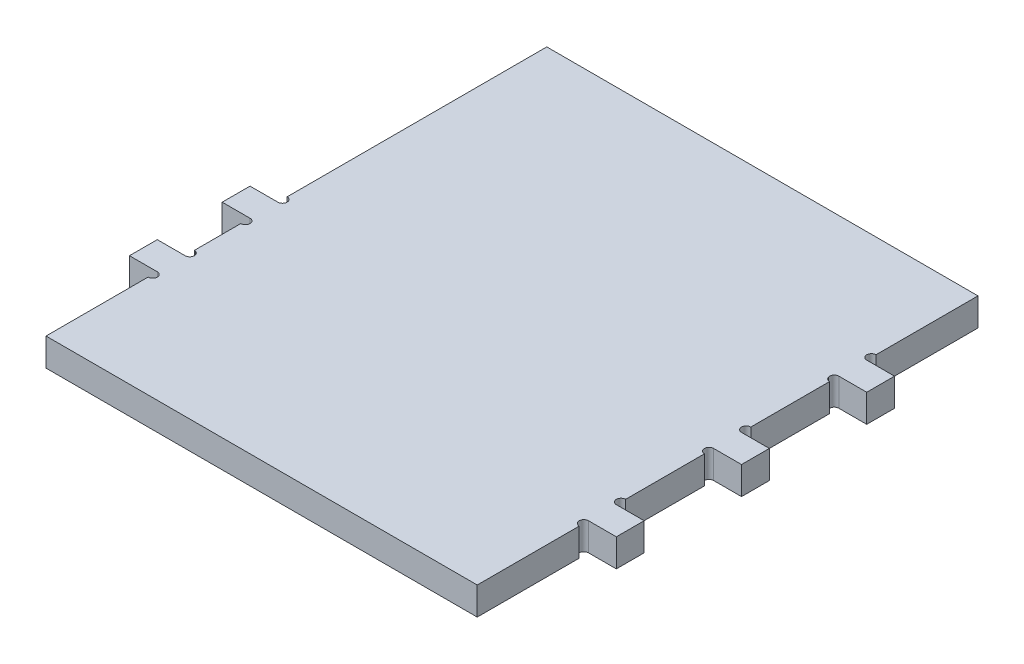
from build123d import *

# Parameters (mm, degrees)
BOSS_EXTRUDE1_DEPTH     = 19.05
CUT_EXTRUDE1_DEPTH      = 466.557212515
CUT_EXTRUDE1_DEPTH_BACK = 466.557212515


with BuildPart() as part:
    # Sketch1 → Boss-Extrude1 (new body)
    with BuildSketch(Plane(origin=(0, 0, 0), x_dir=(1, 0, 0), z_dir=(0, 1, 0))):
        Polygon((0, 0), (295.275, 0), (295.275, 76.2), (314.325, 76.2), (314.325, 95.25), (295.275, 95.25), (295.275, 161.925), (314.325, 161.925), (314.325, 180.975), (295.275, 180.975), (295.275, 247.65), (314.325, 247.65), (314.325, 266.7), (295.275, 266.7), (295.275, 342.9), (0, 342.9), (0, 158.75), (-19.05, 158.75), (-19.05, 139.7), (0, 139.7), (0, 95.25), (-19.05, 95.25), (-19.05, 76.2), (0, 76.2), align=None)
    extrude(amount=BOSS_EXTRUDE1_DEPTH)

    # Sketch2 → Cut-Extrude1 (cut, two sides: drawn at the far end of the back side and taken through both)
    with BuildSketch(Plane(origin=(0, 19.05, 0), x_dir=(1, 0, 0), z_dir=(0, 1, 0)).offset(-CUT_EXTRUDE1_DEPTH_BACK)):
        with BuildLine():
            Line((0, 165.1), (0, 158.75))
            ThreePointArc((0, 158.75), (3.175, 161.925), (0, 165.1))
        make_face()
        with BuildLine():
            Line((0, 139.7), (0, 133.35))
            ThreePointArc((0, 133.35), (3.175, 136.525), (0, 139.7))
        make_face()
        with BuildLine():
            Line((0, 101.6), (0, 95.25))
            ThreePointArc((0, 95.25), (3.175, 98.425), (0, 101.6))
        make_face()
        with BuildLine():
            Line((0, 76.2), (0, 69.85))
            ThreePointArc((0, 69.85), (3.175, 73.025), (0, 76.2))
        make_face()
        with BuildLine():
            Line((295.275, 273.05), (295.275, 266.7))
            ThreePointArc((295.275, 266.7), (292.1, 269.875), (295.275, 273.05))
        make_face()
        with BuildLine():
            Line((295.275, 241.3), (295.275, 247.65))
            ThreePointArc((295.275, 247.65), (292.1, 244.475), (295.275, 241.3))
        make_face()
        with BuildLine():
            Line((295.275, 101.6), (295.275, 95.25))
            ThreePointArc((295.275, 95.25), (292.1, 98.425), (295.275, 101.6))
        make_face()
        with BuildLine():
            Line((295.275, 76.2), (295.275, 69.85))
            ThreePointArc((295.275, 69.85), (292.1, 73.025), (295.275, 76.2))
        make_face()
        with BuildLine():
            Line((295.275, 161.925), (295.275, 155.575))
            ThreePointArc((295.275, 155.575), (292.1, 158.75), (295.275, 161.925))
        make_face()
        with BuildLine():
            Line((295.275, 187.325), (295.275, 180.975))
            ThreePointArc((295.275, 180.975), (292.1, 184.15), (295.275, 187.325))
        make_face()
    extrude(amount=CUT_EXTRUDE1_DEPTH + CUT_EXTRUDE1_DEPTH_BACK, mode=Mode.SUBTRACT)


solid = part.part
